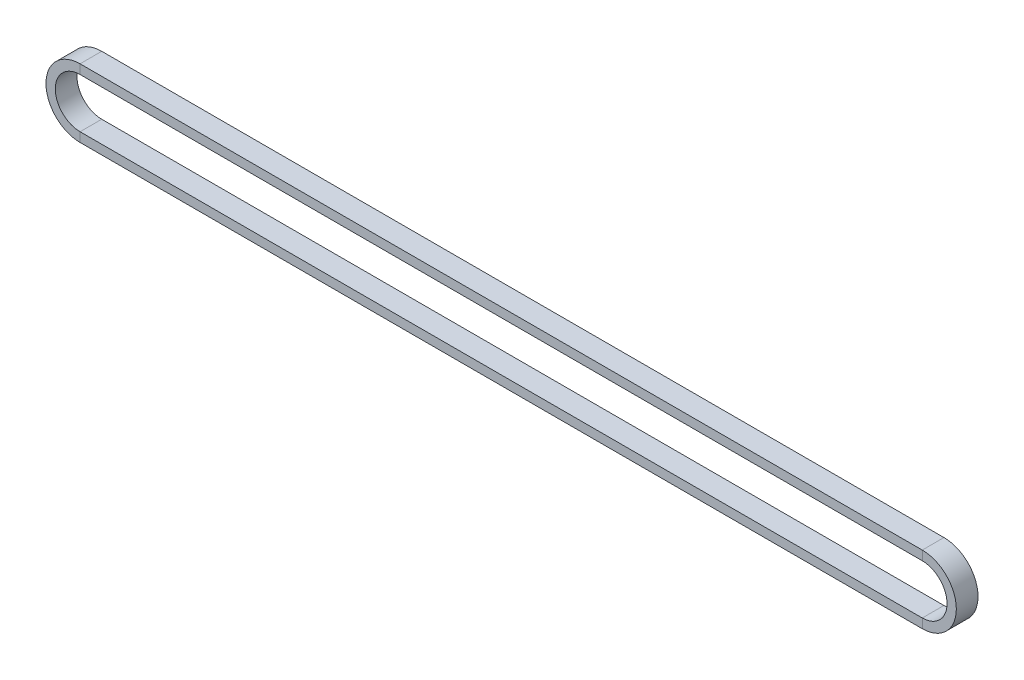
from build123d import *


with BuildPart() as part:
    # Austragung1: sweep along a path in Skizze2
    with BuildLine(Plane.XY) as austragung1_path:
        Line((0, 40), (1360, 40))
        ThreePointArc((1360, 40), (1400, 0), (1360, -40))
        Line((1360, -40), (0, -40))
        ThreePointArc((0, -40), (-40, 0), (0, 40))
    # 3D-Skizze1 → Austragung1 (sweep)
    with BuildSketch(Plane(origin=(1360, 55, -17.5), x_dir=(0, -0.39391929857916763, 0.9191450300180579), z_dir=(-1, 0, 0))):
        Polygon((0, 0), (32.170076051, 13.78717545), (38.078865529, 0), (5.908789479, -13.78717545), align=None)
    sweep(path=austragung1_path.line)


solid = part.part
